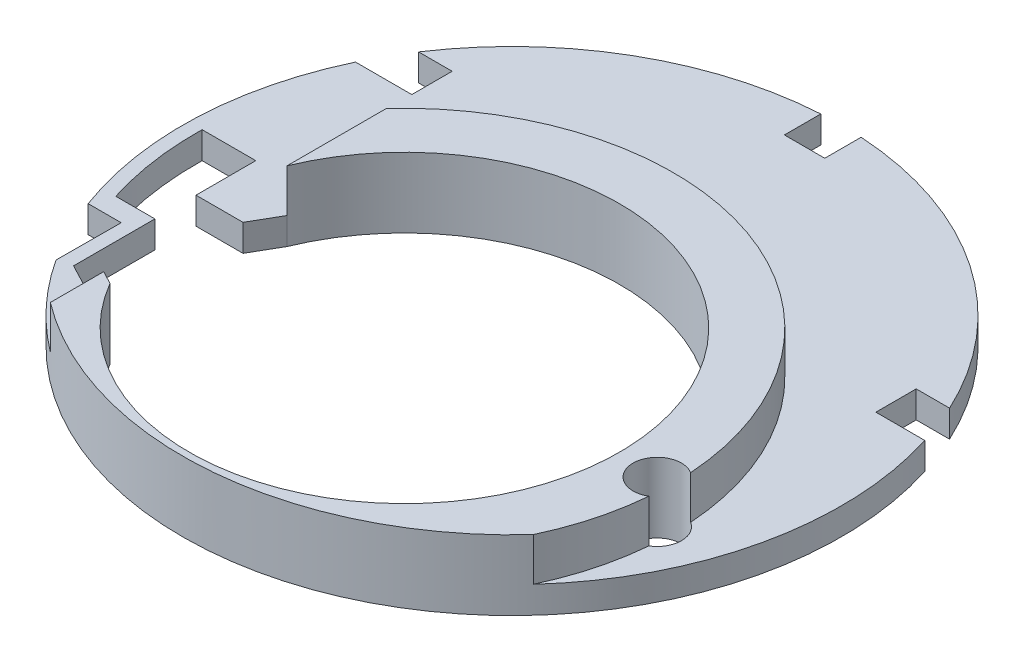
from build123d import *

# Parameters (mm, degrees)
BOSS_EXTRUDE1_DEPTH     = 1
BOSS_EXTRUDE2_DEPTH     = 1.6
CUT_EXTRUDE1_DEPTH      = 18.39784469409933
CUT_EXTRUDE1_DEPTH_BACK = 18.39784469409933
SKETCH2_R               = 0.9000000000000004


with BuildPart() as part:
    # Sketch1 → Boss-Extrude1 (new body)
    with BuildSketch(Plane(origin=(0, 0, 0), x_dir=(1, 0, 0), z_dir=(0, 1, 0))):
        with BuildLine():
            Line((-0.75, 10.875000000000002), (-0.75, 12.227019260637483))
            ThreePointArc((-0.7500000000000002, 12.227019260637485), (-6.131762108207349, 10.604904216840085), (-10.22252415013044, 6.750000000000002))
            Line((-10.222524150130438, 6.750000000000001), (-8.975, 6.750000000000001))
            Line((-8.975, 6.750000000000001), (-8.975, 5.249999999999999))
            Line((-8.975, 5.249999999999999), (-11.067971810589329, 5.249999999999999))
            ThreePointArc((-11.06797181058933, 5.25), (-12.238613585290821, 0.528050669855673), (-11.479034225714315, -4.277180525168357))
            Line((-11.479034225714315, -4.277180525168356), (-10.251454558987772, -4.277180525168356))
            Line((-10.251454558987772, -4.277180525168356), (-10.261976170759779, -6.689868838083338))
            ThreePointArc((-10.26197617075978, -6.68986883808334), (5.219252819608776, -11.082504229866366), (11.693587986584786, 3.65))
            Line((11.693587986584786, 3.6499999999999995), (9.875, 3.6499999999999995))
            Line((9.875, 3.6499999999999995), (9.875, 5.1499999999999995))
            Line((9.875, 5.1499999999999995), (11.114854924829205, 5.1499999999999995))
            ThreePointArc((11.114854924829206, 5.15), (6.9075861196708574, 10.116706677537433), (0.7500000000000135, 12.227019260637483))
            Line((0.7500000000000137, 12.227019260637483), (0.7500000000000137, 10.875000000000002))
            Line((0.7500000000000137, 10.875000000000002), (-0.7500000000000001, 10.875000000000002))
        make_face()
    extrude(amount=BOSS_EXTRUDE1_DEPTH)

    # Sketch3 → Boss-Extrude2 (add)
    with BuildSketch(Plane(origin=(0, 1, 0), x_dir=(1, 0, 0), z_dir=(0, 1, 0))):
        with BuildLine():
            Line((-7.4007200688618315, 2.7252763855729887), (-7.4007200688618315, -0.9620167113123034))
            ThreePointArc((-7.40072006886183, -0.9620167113123008), (1.5482634545040064, 3.8487502365311173), (8, -4.0000000000000036))
            ThreePointArc((8, -4.000000000000005), (1.5482634545039802, -11.84875023653113), (-7.400720068861849, -7.037983288687658))
            Line((-7.400720068861849, -7.037983288687658), (-7.400720068861849, -9.761754066884983))
            ThreePointArc((-7.400720068861847, -9.761754066884983), (1.1153735220053107, -12.199116439579116), (9.048261308939445, -8.257812499999588))
            ThreePointArc((9.048261308939306, -8.257812499999497), (9.759165258601607, -6.181442975487434), (10, -4.000000000000006))
            ThreePointArc((10, -4.0000000000000036), (3.6050519629668107, 5.327572049805301), (-7.400720068861829, 2.7252763855729913))
        make_face()
    extrude(amount=BOSS_EXTRUDE2_DEPTH)

    # Sketch2 → Cut-Extrude1 (cut, two sides: drawn at the far end of the back side and taken through both)
    with BuildSketch(Plane(origin=(0, 1, 0), x_dir=(1, 0, 0), z_dir=(0, 1, 0)).offset(-CUT_EXTRUDE1_DEPTH_BACK)):
        with BuildLine():
            Line((-8.000000000000002, -2.0000000000000036), (-9.747973362219389, -2.0000000000000036))
            Line((-9.747973362219389, -2.0000000000000036), (-9.747973362219389, 0.22281947483164366))
            Line((-9.747973362219389, 0.22281947483164363), (-11.742905111754867, 0.22281947483164344))
            ThreePointArc((-11.742905111754867, 0.22281947483164347), (-11.62509617448331, -1.6740991356715729), (-11.202877600193457, -3.5271805251683066))
            Line((-11.202877600193467, -3.5271805251683563), (-9.747973362219389, -3.5271805251683563))
            Line((-9.747973362219389, -3.5271805251683563), (-9.747973362219389, -6.551525342353796))
            Line((-9.747973362219389, -6.551525342353796), (-6.906384460645114, -8.037555409125643))
            ThreePointArc((-6.906384460645114, -8.037555409125643), (7.980546470676243, -3.4424356275935972), (-7.400720068861833, -0.9620167113123106))
            Line((-7.400720068861836, -0.9620167113123133), (-8.000000000000002, -2.0000000000000036))
        make_face()
        with Locations(Location((9.5, -4.1, 0), (0, 0, 270))):
            Circle(SKETCH2_R)
    extrude(amount=CUT_EXTRUDE1_DEPTH + CUT_EXTRUDE1_DEPTH_BACK, mode=Mode.SUBTRACT)


solid = part.part
